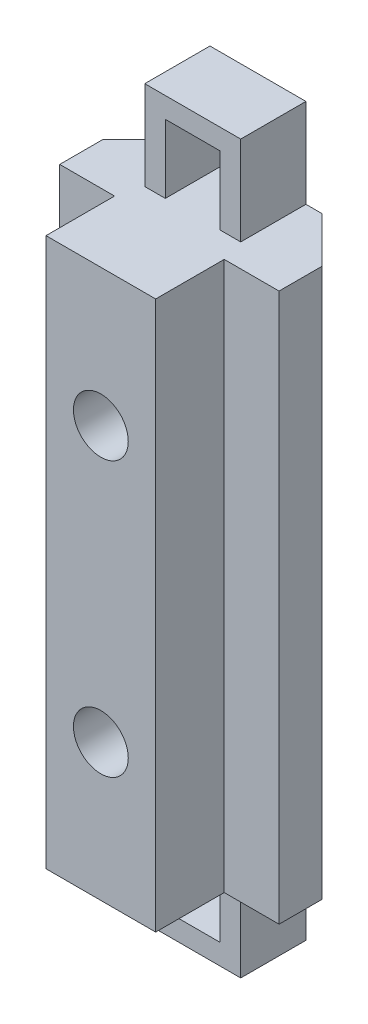
from build123d import *

# Parameters (mm, degrees)
BOSS_EXTRUDE1_DEPTH          = 40
SKETCH2_W                    = 3.5
SKETCH2_H                    = 40
BOSS_EXTRUDE2_DEPTH          = 5
SKETCH4_R                    = 2
CUT_EXTRUDE1_DEPTH           = 7
SKETCH5_R                    = 3.5
CUT_EXTRUDE2_DEPTH           = 3
CUT_EXTRUDE2_DRAFT           = -27
CUT_EXTRUDE2_PROFILE_2_DEPTH = 3
CUT_EXTRUDE2_PROFILE_2_DRAFT = -27
BOSS_EXTRUDE3_DEPTH          = 3
SKETCH9_W                    = 13
SKETCH9_H                    = 40
CUT_EXTRUDE4_DEPTH           = 4.702585656
SKETCH10_W                   = 15
SKETCH10_H                   = 40
BOSS_EXTRUDE4_DEPTH          = 2.5
SKETCH11_W                   = 1.5
SKETCH11_H                   = 2.202585656
BOSS_EXTRUDE7_DEPTH          = 40
BOSS_EXTRUDE8_DEPTH          = 0.625841469
SKETCH13_R                   = 2
CUT_EXTRUDE5_DEPTH           = 10
SKETCH14_W                   = 2.5
SKETCH14_H                   = 40
BOSS_EXTRUDE9_DEPTH          = 0.5
SKETCH15_W                   = 2.5
SKETCH15_H                   = 40
BOSS_EXTRUDE10_DEPTH         = 0.5
BOSS_EXTRUDE11_DEPTH         = 40
BOSS_EXTRUDE12_DEPTH         = 1.13137085
SKETCH18_R                   = 2
CUT_EXTRUDE6_DEPTH           = 10
SKETCH19_R                   = 3
CUT_EXTRUDE7_DEPTH           = 3
CUT_EXTRUDE7_DRAFT           = -19
CUT_EXTRUDE7_PROFILE_2_DEPTH = 3
CUT_EXTRUDE7_PROFILE_2_DRAFT = -19
SKETCH20_W                   = 5
SKETCH20_H                   = 40
BOSS_EXTRUDE13_DEPTH         = 0.5
SKETCH21_W                   = 5
SKETCH21_H                   = 40
BOSS_EXTRUDE14_DEPTH         = 0.5


with BuildPart() as part:
    # Sketch1 → Boss-Extrude1 (new body)
    with BuildSketch(Plane(origin=(0, 0, 0), x_dir=(1, 0, 0), z_dir=(0, 1, 0))):
        Polygon((-4.247892457, 4.702585656), (8.752107543, 4.702585656), (8.752107543, 1.702585656), (7.049521887, 0), (-2.545306801, 0), (-4.247892457, 1.702585656), align=None)
    extrude(amount=BOSS_EXTRUDE1_DEPTH)

    # Sketch2 → Boss-Extrude2 (add)
    with BuildSketch(Plane.XY):
        with Locations((4.002107543, 20)):
            Rectangle(SKETCH2_W, SKETCH2_H)
        with Locations((0.502107543, 20)):
            Rectangle(SKETCH2_W, SKETCH2_H)
    extrude(amount=BOSS_EXTRUDE2_DEPTH)

    # Sketch4 → Cut-Extrude1 (cut)
    with BuildSketch(Plane.XY.offset(5)):
        with Locations((2.252107543, 30)):
            Circle(SKETCH4_R)
        with Locations((2.252107543, 10)):
            Circle(SKETCH4_R)
    extrude(amount=-CUT_EXTRUDE1_DEPTH, mode=Mode.SUBTRACT)


with BuildPart() as cut_extrude2_tool:
    # Sketch5 → Cut-Extrude2 (with draft: the straight prism first)
    with BuildSketch(Plane(origin=(0, 0, -4.702585656), x_dir=(-1, 0, 0), z_dir=(0, 0, -1))):
        with Locations((-2.252107543, 30)):
            Circle(SKETCH5_R)
    extrude(amount=-CUT_EXTRUDE2_DEPTH)
    # Cut-Extrude2: the draft: its side faces are tilted about the plane it starts from
    cut_extrude2_sides = [cut_extrude2_tool.faces().sort_by_distance(p)[0] for p in [
        (5.752107543, 30, -3.202585656),
    ]]
    draft(cut_extrude2_sides, Plane(origin=(0, 0, -4.702585656), x_dir=(-1, 0, 0), z_dir=(0, 0, -1)), CUT_EXTRUDE2_DRAFT)


with BuildPart() as part_1:
    add(part.part)

    # Cut-Extrude2: cut by cut_extrude2_tool
    add(cut_extrude2_tool.part, mode=Mode.SUBTRACT)


with BuildPart() as cut_extrude2_profile_2_tool:
    # Sketch5 → Cut-Extrude2 profile 2 (with draft: the straight prism first)
    with BuildSketch(Plane(origin=(0, 0, -4.702585656), x_dir=(-1, 0, 0), z_dir=(0, 0, -1))):
        with Locations((-2.252107543, 10)):
            Circle(SKETCH5_R)
    extrude(amount=-CUT_EXTRUDE2_PROFILE_2_DEPTH)
    # Cut-Extrude2 profile 2: the draft: its side faces are tilted about the plane it starts from
    cut_extrude2_profile_2_sides = [cut_extrude2_profile_2_tool.faces().sort_by_distance(p)[0] for p in [
        (5.752107543, 10, -3.202585656),
    ]]
    draft(cut_extrude2_profile_2_sides, Plane(origin=(0, 0, -4.702585656), x_dir=(-1, 0, 0), z_dir=(0, 0, -1)), CUT_EXTRUDE2_PROFILE_2_DRAFT)


with BuildPart() as part_2:
    add(part_1.part)

    # Cut-Extrude2 profile 2: cut by cut_extrude2_profile_2_tool
    add(cut_extrude2_profile_2_tool.part, mode=Mode.SUBTRACT)

    # Sketch7 → Boss-Extrude3 (add)
    with BuildSketch(Plane(origin=(0, 0, -4.702585656), x_dir=(-1, 0, 0), z_dir=(0, 0, -1))):
        Polygon((1.247892457, 46.5), (-5.752107543, 46.5), (-5.752107543, 40), (-4.252107543, 40), (-4.252107543, 45), (-0.252107543, 45), (-0.252107543, 43.275204256), (-0.252107543, 40), (1.247892457, 40), align=None)
        Polygon((-4.252107543, 0), (-5.752107543, 0), (-5.752107543, -6.5), (1.247892457, -6.5), (1.247892457, 0), (-0.252107543, 0), (-0.252107543, -5), (-4.252107543, -5), align=None)
    extrude(amount=-BOSS_EXTRUDE3_DEPTH)

    # Sketch9 → Cut-Extrude4 (cut)
    with BuildSketch(Plane(origin=(0, 0, -4.702585656), x_dir=(-1, 0, 0), z_dir=(0, 0, -1))):
        with Locations((-2.252107543, 20)):
            Rectangle(SKETCH9_W, SKETCH9_H)
    extrude(amount=-CUT_EXTRUDE4_DEPTH, mode=Mode.SUBTRACT)


with BuildPart() as cut_extrude4_piece_1:
    # of the separate pieces the step leaves, piece 1, a body of its own (cut_extrude4_pieces)
    add(part_2.part.solids().sort_by_distance((-1.247892457, 0, 0))[0])



with BuildPart() as cut_extrude4_piece_2:
    # of the separate pieces the step leaves, piece 2, a body of its own (cut_extrude4_pieces)
    add(part_2.part.solids().sort_by_distance((0.252107543, 40, -4.702585656))[0])


with BuildPart() as cut_extrude4_piece_3:
    # of the separate pieces the step leaves, piece 3, a body of its own (cut_extrude4_pieces)
    add(part_2.part.solids().sort_by_distance((-1.247892457, -6.5, -4.702585656))[0])


with BuildPart() as cut_extrude4_piece_1_1:
    add(cut_extrude4_piece_1.part)

    add(cut_extrude4_piece_2.part)  # Boss-Extrude4 merges Cut-Extrude4 piece 2

    add(cut_extrude4_piece_3.part)  # Boss-Extrude4 merges Cut-Extrude4 piece 3
    # Sketch10 → Boss-Extrude4 (add)
    with BuildSketch(Plane(origin=(0, 0, 0), x_dir=(-1, 0, 0), z_dir=(0, 0, -1))):
        with Locations((-2.252107543, 20)):
            Rectangle(SKETCH10_W, SKETCH10_H)
    extrude(amount=BOSS_EXTRUDE4_DEPTH)

    # Sketch11 → Boss-Extrude7 (add)
    with BuildSketch(Plane(origin=(0, 0, 0), x_dir=(1, 0, 0), z_dir=(0, 1, 0))):
        with Locations((5.002107543, 3.601292828)):
            Rectangle(SKETCH11_W, SKETCH11_H)
        Polygon((-2.419465332, 5.328427125), (-5.247892457, 2.5), (4.252107543, 2.5), (4.252107543, 4.702585656), (5.752107543, 4.702585656), (5.752107543, 2.5), (9.752107543, 2.5), (6.923680418, 5.328427125), align=None)
    extrude(amount=BOSS_EXTRUDE7_DEPTH)

    # Sketch12 → Boss-Extrude8 (add)
    with BuildSketch(Plane(origin=(0, 0, -4.702585656), x_dir=(-1, 0, 0), z_dir=(0, 0, -1))):
        Polygon((-5.752107543, 0), (-5.752107543, -6.5), (1.247892457, -6.5), (1.247892457, 0), (-0.252107543, 0), (-0.252107543, -5), (-4.252107543, -5), (-4.252107543, 0), align=None)
        Polygon((1.247892457, 46.5), (-5.752107543, 46.5), (-5.752107543, 40), (-4.252107543, 40), (-4.252107543, 45), (-0.252107543, 45), (-0.252107543, 40), (1.247892457, 40), align=None)
    extrude(amount=BOSS_EXTRUDE8_DEPTH)

    # Sketch13 → Cut-Extrude5 (cut)
    with BuildSketch(Plane.XY):
        with Locations((2.252107543, 30)):
            Circle(SKETCH13_R)
        with Locations((2.252107543, 10)):
            Circle(SKETCH13_R)
    extrude(amount=-CUT_EXTRUDE5_DEPTH, mode=Mode.SUBTRACT)

    # Sketch14 → Boss-Extrude9 (add)
    with BuildSketch(Plane(origin=(9.752107543, 0, 0), x_dir=(0, 0, -1), z_dir=(1, 0, 0))):
        with Locations((1.25, 20)):
            Rectangle(SKETCH14_W, SKETCH14_H)
    extrude(amount=BOSS_EXTRUDE9_DEPTH)

    # Sketch15 → Boss-Extrude10 (add)
    with BuildSketch(Plane.ZY.offset(5.247892457)):
        with Locations((-1.25, 20)):
            Rectangle(SKETCH15_W, SKETCH15_H)
    extrude(amount=BOSS_EXTRUDE10_DEPTH)

    # Sketch16 → Boss-Extrude11 (add)
    with BuildSketch(Plane.XZ):
        Polygon((-2.419465332, -5.328427125), (-5.247892457, -2.5), (-5.747892457, -2.5), (-5.747892457, -3.13137085), (-2.419465332, -6.459797975), (6.923680418, -6.459797975), (10.252107543, -3.13137085), (10.252107543, -2.5), (9.752107543, -2.5), (6.923680418, -5.328427125), (0.656985658, -5.328427125), align=None)
    extrude(amount=-BOSS_EXTRUDE11_DEPTH)

    # Sketch17 → Boss-Extrude12 (add)
    with BuildSketch(Plane(origin=(0, 0, -5.328427125), x_dir=(-1, 0, 0), z_dir=(0, 0, -1))):
        Polygon((-5.752107543, 0), (-5.752107543, -6.5), (1.247892457, -6.5), (1.247892457, 0), (0, 0), (0, -5), (-0.252107543, -5), (-4.252107543, -5), (-4.252107543, 0), align=None)
        Polygon((1.247892457, 46.5), (-5.752107543, 46.5), (-5.752107543, 40), (-4.252107543, 40), (-4.252107543, 44.953142187), (-0.252107543, 44.953142187), (-0.252107543, 40), (1.247892457, 40), align=None)
    extrude(amount=BOSS_EXTRUDE12_DEPTH)

    # Sketch18 → Cut-Extrude6 (cut)
    with BuildSketch(Plane.XY.offset(-5.328427125)):
        with Locations((2.252107543, 30)):
            Circle(SKETCH18_R)
        with Locations((2.252107543, 10)):
            Circle(SKETCH18_R)
    extrude(amount=-CUT_EXTRUDE6_DEPTH, mode=Mode.SUBTRACT)


with BuildPart() as cut_extrude7_tool:
    # Sketch19 → Cut-Extrude7 (with draft: the straight prism first)
    with BuildSketch(Plane(origin=(0, 0, -6.459797975), x_dir=(-1, 0, 0), z_dir=(0, 0, -1))):
        with Locations((-2.252107543, 30)):
            Circle(SKETCH19_R)
    extrude(amount=-CUT_EXTRUDE7_DEPTH)
    # Cut-Extrude7: the draft: its side faces are tilted about the plane it starts from
    cut_extrude7_sides = [cut_extrude7_tool.faces().sort_by_distance(p)[0] for p in [
        (5.252107543, 30, -4.959797975),
    ]]
    draft(cut_extrude7_sides, Plane(origin=(0, 0, -6.459797975), x_dir=(-1, 0, 0), z_dir=(0, 0, -1)), CUT_EXTRUDE7_DRAFT)


with BuildPart() as cut_extrude4_piece_1_2:
    add(cut_extrude4_piece_1_1.part)

    # Cut-Extrude7: cut by cut_extrude7_tool
    add(cut_extrude7_tool.part, mode=Mode.SUBTRACT)


with BuildPart() as cut_extrude7_profile_2_tool:
    # Sketch19 → Cut-Extrude7 profile 2 (with draft: the straight prism first)
    with BuildSketch(Plane(origin=(0, 0, -6.459797975), x_dir=(-1, 0, 0), z_dir=(0, 0, -1))):
        with Locations((-2.252107543, 10)):
            Circle(SKETCH19_R)
    extrude(amount=-CUT_EXTRUDE7_PROFILE_2_DEPTH)
    # Cut-Extrude7 profile 2: the draft: its side faces are tilted about the plane it starts from
    cut_extrude7_profile_2_sides = [cut_extrude7_profile_2_tool.faces().sort_by_distance(p)[0] for p in [
        (5.252107543, 10, -4.959797975),
    ]]
    draft(cut_extrude7_profile_2_sides, Plane(origin=(0, 0, -6.459797975), x_dir=(-1, 0, 0), z_dir=(0, 0, -1)), CUT_EXTRUDE7_PROFILE_2_DRAFT)


with BuildPart() as cut_extrude4_piece_1_3:
    add(cut_extrude4_piece_1_2.part)

    # Cut-Extrude7 profile 2: cut by cut_extrude7_profile_2_tool
    add(cut_extrude7_profile_2_tool.part, mode=Mode.SUBTRACT)

    # Sketch20 → Boss-Extrude13 (add)
    with BuildSketch(Plane.ZY.offset(1.247892457)):
        with Locations((2.5, 20)):
            Rectangle(SKETCH20_W, SKETCH20_H)
    extrude(amount=BOSS_EXTRUDE13_DEPTH)

    # Sketch21 → Boss-Extrude14 (add)
    with BuildSketch(Plane(origin=(5.752107543, 0, 0), x_dir=(0, 0, -1), z_dir=(1, 0, 0))):
        with Locations((-2.5, 20)):
            Rectangle(SKETCH21_W, SKETCH21_H)
    extrude(amount=BOSS_EXTRUDE14_DEPTH)


solid = cut_extrude4_piece_1_3.part
